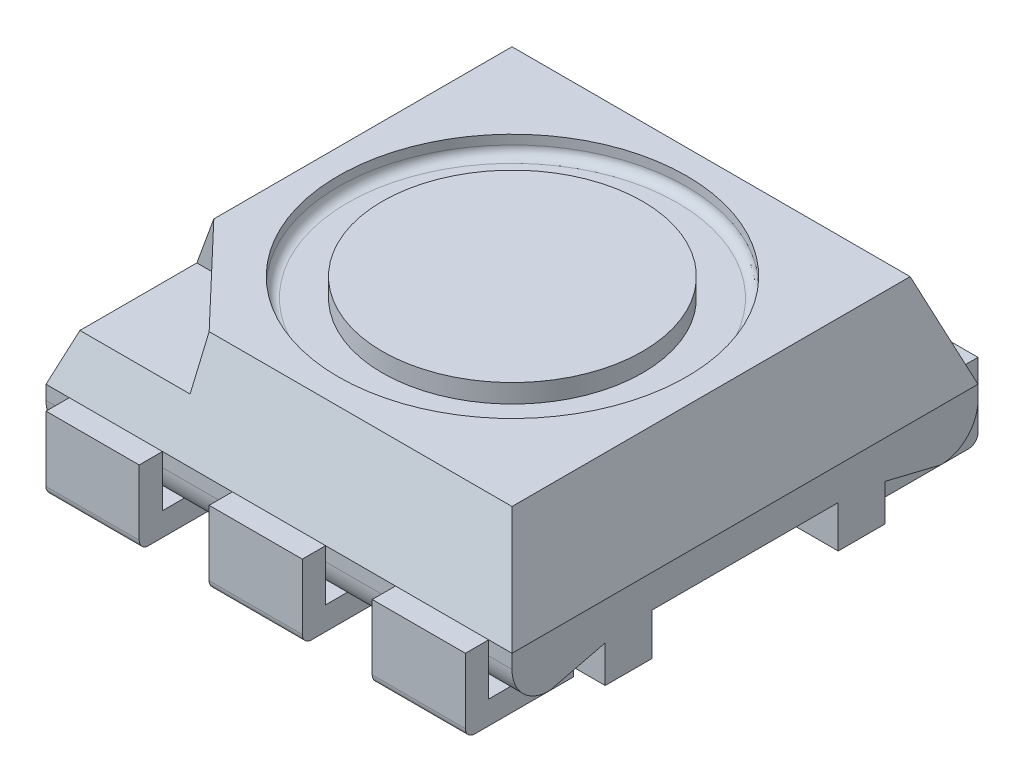
from build123d import *

# Parameters (mm, degrees)
SKETCH2_W            = 5
SKETCH2_H            = 5
BOSS_EXTRUDE1_DEPTH  = 1
DRAFT7_ANGLE         = -20
SKETCH11_W           = 5
SKETCH11_H           = 5
BOSS_EXTRUDE2_DEPTH  = 0.8
SKETCH13_W           = 5
SKETCH13_H           = 2
CUT_EXTRUDE2_DEPTH   = 0.45
SKETCH16_W           = 6.350821673
SKETCH16_H           = 1.151538179
SKETCH16_W_2         = 6.761464042
SKETCH16_H_2         = 1.243103438
CUT_EXTRUDE3_DEPTH   = 0.25
FILLET11_R           = 0.4
FILLET12_R           = 0.4
CUT_EXTRUDE4_DEPTH   = 5
BOSS_EXTRUDE9_START  = -2
BOSS_EXTRUDE9_DEPTH  = 1
LPATTERN2_COUNT      = 2
LPATTERN2_PITCH      = 1.75
LPATTERN2_COL_COUNT  = 2
LPATTERN2_COL_PITCH  = 1.75
CIRPATTERN6_COUNT    = 2
SKETCH28_R           = 1.868239663
CUT_EXTRUDE5_DEPTH   = 0.2
SKETCH30_R           = 1.395755899
BOSS_EXTRUDE10_DEPTH = 0.2
FILLET14_R           = 0.1
CUT_EXTRUDE6_DEPTH   = 0.5


with BuildPart() as part:
    # Sketch2 → Boss-Extrude1 (new body)
    with BuildSketch(Plane(origin=(0, 0, 0), x_dir=(1, 0, 0), z_dir=(0, 1, 0))):
        with Locations((0.948529146, -0.312763622)):
            Rectangle(SKETCH2_W, SKETCH2_H)
    extrude(amount=BOSS_EXTRUDE1_DEPTH)

    # Draft7
    draft7_faces = [part.faces().sort_by_distance(p)[0] for p in [
        (0.948529146, 0.5, 2.812763622),
        (-1.551470854, 0.5, 0.312763622),
        (3.448529146, 0.5, 0.312763622),
        (0.948529146, 0.5, -2.187236378),
    ]]
    draft(draft7_faces, Plane(origin=(0, 0, 0), x_dir=(0, 0, -1), z_dir=(0, -1, 0)), DRAFT7_ANGLE)

    # Sketch11 → Boss-Extrude2 (add)
    with BuildSketch(Plane.XZ):
        with Locations((0.948529146, 0.312763622)):
            Rectangle(SKETCH11_W, SKETCH11_H)
    extrude(amount=BOSS_EXTRUDE2_DEPTH)

    # Sketch13 → Cut-Extrude2 (cut)
    with BuildSketch(Plane.XZ.offset(0.8)):
        with Locations((0.948529146, 0.312763622)):
            Rectangle(SKETCH13_W, SKETCH13_H)
    extrude(amount=-CUT_EXTRUDE2_DEPTH, mode=Mode.SUBTRACT)

    # Sketch16 → Cut-Extrude3 (cut)
    with BuildSketch(Plane.XZ.offset(0.8)):
        with Locations((0.752953726, 2.388532712)):
            Rectangle(SKETCH16_W, SKETCH16_H)
        with Locations((0.95827491, -1.808788097)):
            Rectangle(SKETCH16_W_2, SKETCH16_H_2)
    extrude(amount=-CUT_EXTRUDE3_DEPTH, mode=Mode.SUBTRACT)

    # Fillet11
    fillet11_edges = [part.edges().sort_by_distance(p)[0] for p in [
        (0.948529146, -0.55, 2.812763622),
    ]]
    fillet(fillet11_edges, radius=FILLET11_R)

    # Fillet12
    fillet12_edges = [part.edges().sort_by_distance(p)[0] for p in [
        (0.948529146, -0.55, -2.187236378),
    ]]
    fillet(fillet12_edges, radius=FILLET12_R)

    # Sketch24 → Cut-Extrude4 (cut)
    with BuildSketch(Plane(origin=(3.448529146, 0, 0), x_dir=(0, 0, -1), z_dir=(1, 0, 0))):
        Polygon((-2.412763622, -0.55), (-1.812763622, -0.403148712), (-1.812763622, -0.55), align=None)
        Polygon((1.787236378, -0.55), (1.187236378, -0.403148712), (1.187236378, -0.55), align=None)
    extrude(amount=-CUT_EXTRUDE4_DEPTH, mode=Mode.SUBTRACT)

    # Sketch28 → Cut-Extrude5 (cut)
    with BuildSketch(Plane(origin=(0, 1, 0), x_dir=(1, 0, 0), z_dir=(0, 1, 0))):
        with Locations(Location((0.948529146, -0.307847377, 0), (0, 0, 270))):
            Circle(SKETCH28_R)
    extrude(amount=-CUT_EXTRUDE5_DEPTH, mode=Mode.SUBTRACT)

    # Sketch30 → Boss-Extrude10 (add)
    with BuildSketch(Plane(origin=(0, 0.8, 0), x_dir=(1, 0, 0), z_dir=(0, 1, 0))):
        with Locations(Location((0.948529146, -0.307847377, 0), (0, 0, 270))):
            Circle(SKETCH30_R)
    extrude(amount=BOSS_EXTRUDE10_DEPTH)

    # Fillet14
    fillet14_edges = [part.edges().sort_by_distance(p)[0] for p in [
        (0.948529146, 0.8, -1.560392286),
    ]]
    fillet(fillet14_edges, radius=FILLET14_R)

    # Sketch31 → Cut-Extrude6 (cut)
    with BuildSketch(Plane(origin=(0, 1, 0), x_dir=(1, 0, 0), z_dir=(0, 1, 0))):
        Polygon((-1.18750062, -1.376055043), (-0.164892317, -2.448793387), (-0.327231639, -3.758878508), (-2.600762658, -3.636008881), (-2.394545861, -1.376055043), align=None)
    extrude(amount=-CUT_EXTRUDE6_DEPTH, mode=Mode.SUBTRACT)


with BuildPart() as body_2:
    # Sketch25 → Boss-Extrude9 (new body)
    with BuildSketch(Plane.ZY.offset(1.551470854).offset(BOSS_EXTRUDE9_START)):
        with BuildLine():
            Line((2.812763622, 0), (3.062763622, 0))
            Line((3.062763622, 0), (3.062763622, -0.7))
            ThreePointArc((3.062763622, -0.7), (3.0334743, -0.770710678), (2.962763622, -0.8))
            Line((2.962763622, -0.8), (1.903719398, -0.8))
            Line((1.903719398, -0.8), (1.903719398, -0.55))
            Line((1.903719398, -0.55), (2.812763622, -0.55))
            Line((2.812763622, -0.55), (2.812763622, 0))
        make_face()
    boss_extrude9 = extrude(amount=-BOSS_EXTRUDE9_DEPTH)


with BuildPart() as lpattern2_1:
    # LPattern2: Boss-Extrude9 ×2
    with Locations(*[(i * LPATTERN2_PITCH, 0, 0) for i in range(1, LPATTERN2_COUNT)]):
        add(boss_extrude9)


with BuildPart() as lpattern2_col_1:
    # LPattern2 col: Boss-Extrude9 ×2
    with Locations(*[(-i * LPATTERN2_COL_PITCH, 0, 0) for i in range(1, LPATTERN2_COL_COUNT)]):
        add(boss_extrude9)


with BuildPart() as cirpattern6_1:
    # CirPattern6: pattern copy
    add(lpattern2_col_1.part.rotate(Axis((0.948529146, 0, 0.312763622), (0, 1, 0)), 1 * 360 / CIRPATTERN6_COUNT))


with BuildPart() as cirpattern6_2:
    # CirPattern6: pattern copy
    add(body_2.part.rotate(Axis((0.948529146, 0, 0.312763622), (0, 1, 0)), 1 * 360 / CIRPATTERN6_COUNT))


with BuildPart() as cirpattern6_3:
    # CirPattern6: pattern copy
    add(lpattern2_1.part.rotate(Axis((0.948529146, 0, 0.312763622), (0, 1, 0)), 1 * 360 / CIRPATTERN6_COUNT))


with BuildPart() as part_1:
    # Body-Move/Copy2: moved
    add(part.part.moved(Location((0, 0.80000005, 0))))


with BuildPart() as body_2_1:
    # Body-Move/Copy2: moved
    add(body_2.part.moved(Location((0, 0.80000005, 0))))


with BuildPart() as lpattern2_1_1:
    # Body-Move/Copy2: moved
    add(lpattern2_1.part.moved(Location((0, 0.80000005, 0))))


with BuildPart() as lpattern2_col_1_1:
    # Body-Move/Copy2: moved
    add(lpattern2_col_1.part.moved(Location((0, 0.80000005, 0))))


with BuildPart() as cirpattern6_1_1:
    # Body-Move/Copy2: moved
    add(cirpattern6_1.part.moved(Location((0, 0.80000005, 0))))


with BuildPart() as cirpattern6_2_1:
    # Body-Move/Copy2: moved
    add(cirpattern6_2.part.moved(Location((0, 0.80000005, 0))))


with BuildPart() as cirpattern6_3_1:
    # Body-Move/Copy2: moved
    add(cirpattern6_3.part.moved(Location((0, 0.80000005, 0))))


with BuildPart() as part_2:
    # Body-Move/Copy3: moved
    add(part_1.part.moved(Location((-34.584381822, -0.535917987, 0.006837871))))


with BuildPart() as body_2_2:
    # Body-Move/Copy3: moved
    add(body_2_1.part.moved(Location((-34.584381822, -0.535917987, 0.006837871))))


with BuildPart() as lpattern2_1_2:
    # Body-Move/Copy3: moved
    add(lpattern2_1_1.part.moved(Location((-34.584381822, -0.535917987, 0.006837871))))


with BuildPart() as lpattern2_col_1_2:
    # Body-Move/Copy3: moved
    add(lpattern2_col_1_1.part.moved(Location((-34.584381822, -0.535917987, 0.006837871))))


with BuildPart() as cirpattern6_1_2:
    # Body-Move/Copy3: moved
    add(cirpattern6_1_1.part.moved(Location((-34.584381822, -0.535917987, 0.006837871))))


with BuildPart() as cirpattern6_2_2:
    # Body-Move/Copy3: moved
    add(cirpattern6_2_1.part.moved(Location((-34.584381822, -0.535917987, 0.006837871))))


with BuildPart() as cirpattern6_3_2:
    # Body-Move/Copy3: moved
    add(cirpattern6_3_1.part.moved(Location((-34.584381822, -0.535917987, 0.006837871))))


with BuildPart() as part_3:
    # Body-Move/Copy4: moved
    add(part_2.part.moved(Location((33.663979282, 0, -0.458470257))))


with BuildPart() as body_2_3:
    # Body-Move/Copy4: moved
    add(body_2_2.part.moved(Location((33.663979282, 0, -0.458470257))))


with BuildPart() as lpattern2_1_3:
    # Body-Move/Copy4: moved
    add(lpattern2_1_2.part.moved(Location((33.663979282, 0, -0.458470257))))


with BuildPart() as lpattern2_col_1_3:
    # Body-Move/Copy4: moved
    add(lpattern2_col_1_2.part.moved(Location((33.663979282, 0, -0.458470257))))


with BuildPart() as cirpattern6_1_3:
    # Body-Move/Copy4: moved
    add(cirpattern6_1_2.part.moved(Location((33.663979282, 0, -0.458470257))))


with BuildPart() as cirpattern6_2_3:
    # Body-Move/Copy4: moved
    add(cirpattern6_2_2.part.moved(Location((33.663979282, 0, -0.458470257))))


with BuildPart() as cirpattern6_3_3:
    # Body-Move/Copy4: moved
    add(cirpattern6_3_2.part.moved(Location((33.663979282, 0, -0.458470257))))


with BuildPart() as part_4:
    # Body-Move/Copy5: moved
    add(part_3.part.moved(Location((0, 0.55, 0))))


with BuildPart() as body_2_4:
    # Body-Move/Copy5: moved
    add(body_2_3.part.moved(Location((0, 0.55, 0))))


with BuildPart() as lpattern2_1_4:
    # Body-Move/Copy5: moved
    add(lpattern2_1_3.part.moved(Location((0, 0.55, 0))))


with BuildPart() as lpattern2_col_1_4:
    # Body-Move/Copy5: moved
    add(lpattern2_col_1_3.part.moved(Location((0, 0.55, 0))))


with BuildPart() as cirpattern6_1_4:
    # Body-Move/Copy5: moved
    add(cirpattern6_1_3.part.moved(Location((0, 0.55, 0))))


with BuildPart() as cirpattern6_2_4:
    # Body-Move/Copy5: moved
    add(cirpattern6_2_3.part.moved(Location((0, 0.55, 0))))


with BuildPart() as cirpattern6_3_4:
    # Body-Move/Copy5: moved
    add(cirpattern6_3_3.part.moved(Location((0, 0.55, 0))))


solid = Compound([part_4.part, body_2_4.part, lpattern2_1_4.part, lpattern2_col_1_4.part, cirpattern6_1_4.part, cirpattern6_2_4.part, cirpattern6_3_4.part])
